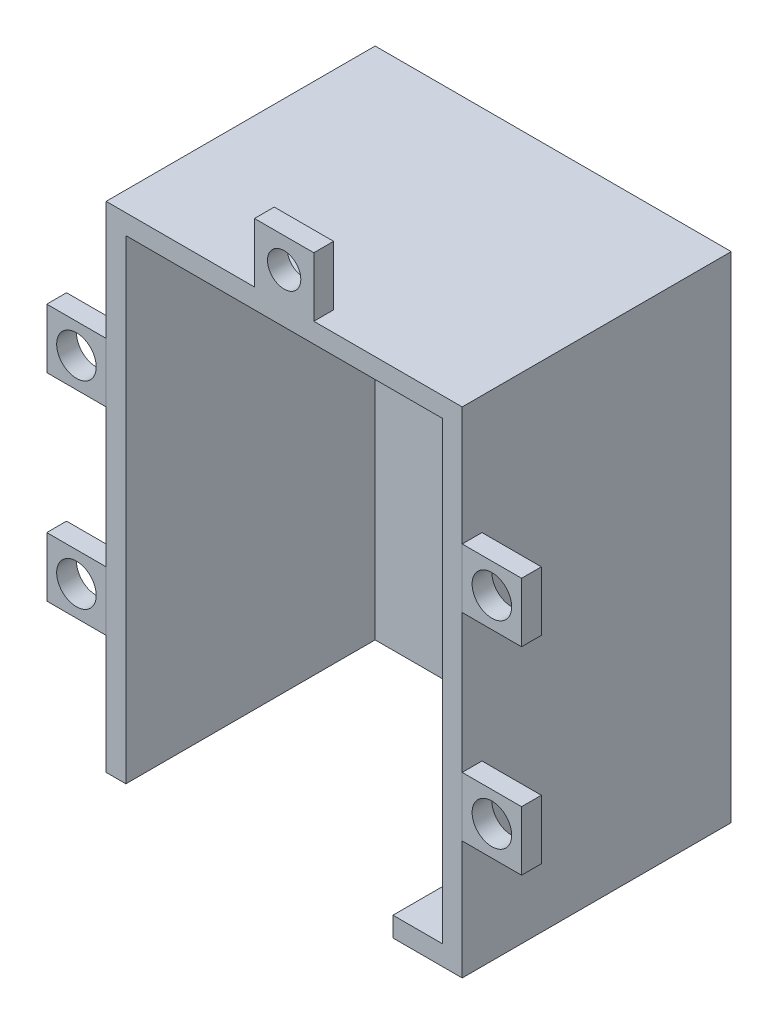
from build123d import *

# Parameters (mm, degrees)
SKETCH1_W           = 36
SKETCH1_H           = 50
BOSS_EXTRUDE1_DEPTH = 27.2
CUT_EXTRUDE1_REACH  = 69.349
SKETCH2_R           = 3
SKETCH8_W           = 32
SKETCH8_H           = 46
CUT_EXTRUDE2_DEPTH  = 25.2
SKETCH12_W          = 1
SKETCH12_H          = 0.6
SKETCH12_W_2        = 0.8
SKETCH12_H_2        = 1.2
CUT_EXTRUDE3_DEPTH  = 25.2
SKETCH14_W          = 32
SKETCH14_H          = 25.2
CUT_EXTRUDE4_DEPTH  = 25.2
SKETCH16_W          = 5
SKETCH16_H          = 25.2
BOSS_EXTRUDE2_DEPTH = 2
SKETCH17_W          = 6
SKETCH17_H          = 6
BOSS_EXTRUDE3_DEPTH = 2
SKETCH18_R          = 2
CUT_EXTRUDE5_DEPTH  = 2
SKETCH20_W          = 6
SKETCH20_H          = 6
BOSS_EXTRUDE4_DEPTH = 2
SKETCH21_R          = 1.684389361
CUT_EXTRUDE6_DEPTH  = 2


with BuildPart() as part:
    # Sketch1 → Boss-Extrude1 (new body)
    with BuildSketch(Plane.XY):
        with Locations((18, 25)):
            Rectangle(SKETCH1_W, SKETCH1_H)
    extrude(amount=-BOSS_EXTRUDE1_DEPTH)

    # Sketch2 → Cut-Extrude1 (cut, up to next)
    with BuildSketch(Plane.XY, mode=Mode.PRIVATE) as cut_extrude1_sk1:
        with Locations((18, 33)):
            Circle(SKETCH2_R)
    cut_extrude1_tool1 = extrude(cut_extrude1_sk1.sketch, amount=-CUT_EXTRUDE1_REACH, mode=Mode.PRIVATE) & part.part
    add(cut_extrude1_tool1.solids().sort_by_distance((18, 33, 0))[0], mode=Mode.SUBTRACT)

    # Sketch8 → Cut-Extrude2 (cut)
    with BuildSketch(Plane.XY):
        with Locations((18, 25)):
            Rectangle(SKETCH8_W, SKETCH8_H)
    extrude(amount=-CUT_EXTRUDE2_DEPTH, mode=Mode.SUBTRACT)

    # Sketch12 → Cut-Extrude3 (cut)
    with BuildSketch(Plane(origin=(0, 0, -27.2), x_dir=(-1, 0, 0), z_dir=(0, 0, -1))):
        with Locations((-14, 13.25)):
            Rectangle(SKETCH12_W, SKETCH12_H)
        with Locations((-18, 13.25)):
            Rectangle(SKETCH12_W, SKETCH12_H)
        with Locations((-22, 13.25)):
            Rectangle(SKETCH12_W, SKETCH12_H)
        with Locations((-13, 23.35)):
            Rectangle(SKETCH12_W_2, SKETCH12_H_2)
        with Locations((-23, 23.35)):
            Rectangle(SKETCH12_W_2, SKETCH12_H_2)
    extrude(amount=-CUT_EXTRUDE3_DEPTH, mode=Mode.SUBTRACT)

    # Sketch14 → Cut-Extrude4 (cut)
    with BuildSketch(Plane.XZ):
        with Locations((18, -12.6)):
            Rectangle(SKETCH14_W, SKETCH14_H)
    extrude(amount=-CUT_EXTRUDE4_DEPTH, mode=Mode.SUBTRACT)

    # Sketch16 → Boss-Extrude2 (add)
    with BuildSketch(Plane(origin=(0, 0, 0), x_dir=(-1, 0, 0), z_dir=(0, -1, 0))):
        with Locations((-31.5, 12.6)):
            Rectangle(SKETCH16_W, SKETCH16_H)
    extrude(amount=-BOSS_EXTRUDE2_DEPTH)

    # Sketch20 → Boss-Extrude4 (add)
    with BuildSketch(Plane.XY):
        with Locations((18, 53)):
            Rectangle(SKETCH20_W, SKETCH20_H)
    extrude(amount=-BOSS_EXTRUDE4_DEPTH)

    # Sketch21 → Cut-Extrude6 (cut)
    with BuildSketch(Plane.XY):
        with Locations((18, 53)):
            Circle(SKETCH21_R)
    extrude(amount=-CUT_EXTRUDE6_DEPTH, mode=Mode.SUBTRACT)


with BuildPart() as body_2:
    # Sketch17 → Boss-Extrude3 (new body)
    with BuildSketch(Plane.XY):
        with Locations((39, 35)):
            Rectangle(SKETCH17_W, SKETCH17_H)
    extrude(amount=-BOSS_EXTRUDE3_DEPTH)

    # Sketch18 → Cut-Extrude5 (cut)
    with BuildSketch(Plane.XY):
        with Locations((39, 35)):
            Circle(SKETCH18_R)
    extrude(amount=-CUT_EXTRUDE5_DEPTH, mode=Mode.SUBTRACT)


with BuildPart() as body_3:
    # Mirror1: mirrored copy
    add(body_2.part.mirror(Plane(origin=(0, 25, 0), x_dir=(0, 0, 1), z_dir=(0, -1, 0))))


with BuildPart() as body_4:
    # Mirror2: mirrored copy
    add(body_2.part.mirror(Plane.ZY.offset(-18)))


with BuildPart() as body_5:
    # Mirror2 2: mirrored copy
    add(body_3.part.mirror(Plane.ZY.offset(-18)))


solid = Compound([part.part, body_2.part, body_3.part, body_4.part, body_5.part])
